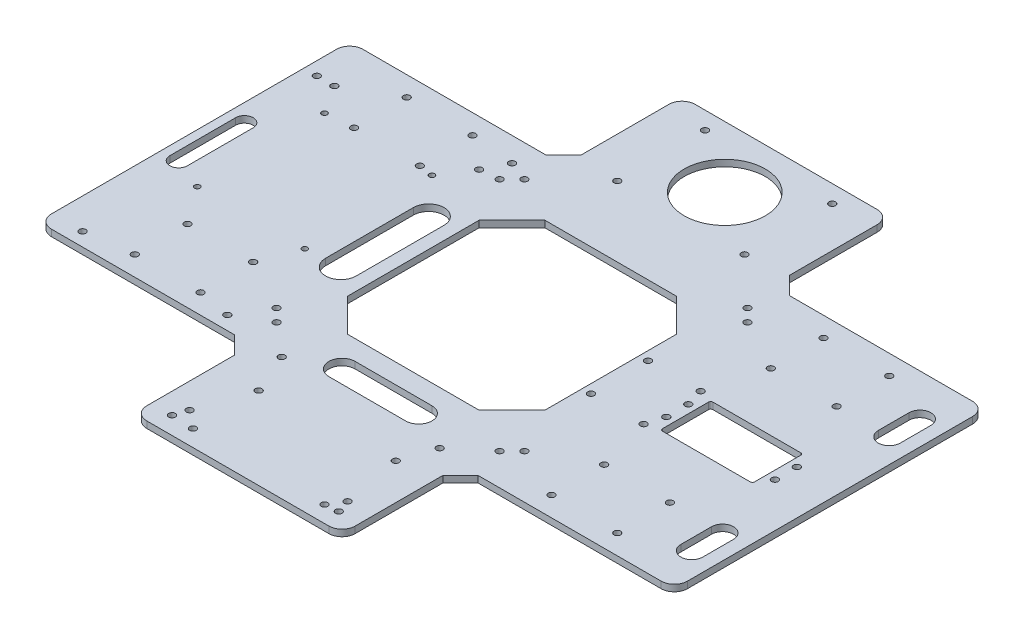
from build123d import *

# Parameters (mm, degrees)
EXTRUDE_1_DEPTH      = 3
SKETCH_2_R           = 1.5
CUT_EXTRUDE_1_DEPTH  = 3
SKETCH_3_R           = 18.5
SKETCH_3_R_2         = 1.5
CUT_EXTRUDE_2_DEPTH  = 10
SKETCH_4_W           = 90
SKETCH_4_H           = 90
CUT_EXTRUDE_3_DEPTH  = 3
FILLET_3_R           = 6
CHAMFER_1_SIZE       = 8
CUT_EXTRUDE_6_DEPTH  = 10
CHAMFER_2_SIZE       = 15
SKETCH_8_R           = 1.5
CUT_EXTRUDE_7_DEPTH  = 10
SKETCH_9_R           = 1.5
CUT_EXTRUDE_8_DEPTH  = 10
CUT_EXTRUDE_9_DEPTH  = 10
SKETCH_14_R          = 1.5
CUT_EXTRUDE_10_DEPTH = 10
SKETCH_15_R          = 1.5
SKETCH_15_W          = 42
SKETCH_15_H          = 23
CUT_EXTRUDE_11_DEPTH = 10
FILLET_4_R           = 1
SKETCH_16_R          = 1.25
CUT_EXTRUDE_12_DEPTH = 10
SKETCH_19_R          = 1.5
CUT_EXTRUDE_13_DEPTH = 10
SKETCH_20_R          = 1.5
CUT_EXTRUDE_14_DEPTH = 10
SKETCH_21_R          = 1.5
CUT_EXTRUDE_15_DEPTH = 10
SKETCH_22_R          = 1.5
CUT_EXTRUDE_16_DEPTH = 10


with BuildPart() as part:
    # 草图1 → 凸台-拉伸1 (new body)
    with BuildSketch(Plane(origin=(0, 0, 0), x_dir=(1, 0, 0), z_dir=(0, 1, 0))):
        Polygon((-47.5, -71), (-47.5, -125), (47.5, -125), (47.5, -71), (145, -71), (145, 71), (47.5, 71), (47.5, 125), (-47.5, 125), (-47.5, 71), (-145, 71), (-145, -71), align=None)
    extrude(amount=EXTRUDE_1_DEPTH)

    # 草图2 → 切除-拉伸1 (cut)
    with BuildSketch(Plane(origin=(0, 3, 0), x_dir=(1, 0, 0), z_dir=(0, 1, 0))):
        with Locations(Location((110, 62, 0), (0, 0, 270))):
            Circle(SKETCH_2_R)
        with Locations(Location((80, 62, 0), (0, 0, 270))):
            Circle(SKETCH_2_R)
        with Locations(Location((80, 38, 0), (0, 0, 270))):
            Circle(SKETCH_2_R)
        with Locations(Location((110, 38, 0), (0, 0, 270))):
            Circle(SKETCH_2_R)
        with Locations(Location((110, -38, 0), (0, 0, 90))):
            Circle(SKETCH_2_R)
        with Locations(Location((110, -62, 0), (0, 0, 90))):
            Circle(SKETCH_2_R)
        with Locations(Location((80, -38, 0), (0, 0, 90))):
            Circle(SKETCH_2_R)
        with Locations(Location((80, -62, 0), (0, 0, 90))):
            Circle(SKETCH_2_R)
        with Locations(Location((-80, -62, 0), (0, 0, 270))):
            Circle(SKETCH_2_R)
        with Locations(Location((-80, -38, 0), (0, 0, 270))):
            Circle(SKETCH_2_R)
        with Locations(Location((-110, -62, 0), (0, 0, 270))):
            Circle(SKETCH_2_R)
        with Locations(Location((-110, -38, 0), (0, 0, 270))):
            Circle(SKETCH_2_R)
        with Locations(Location((-110, 38, 0), (0, 0, 90))):
            Circle(SKETCH_2_R)
        with Locations(Location((-80, 38, 0), (0, 0, 90))):
            Circle(SKETCH_2_R)
        with Locations(Location((-80, 62, 0), (0, 0, 90))):
            Circle(SKETCH_2_R)
        with Locations(Location((-110, 62, 0), (0, 0, 90))):
            Circle(SKETCH_2_R)
    extrude(amount=-CUT_EXTRUDE_1_DEPTH, mode=Mode.SUBTRACT)

    # 草图3 → 切除-拉伸2 (cut)
    with BuildSketch(Plane(origin=(0, 3, 0), x_dir=(1, 0, 0), z_dir=(0, 1, 0))):
        with Locations(Location((0, 97, 0), (0, 0, 270))):
            Circle(SKETCH_3_R)
        with Locations(Location((29, 117, 0), (0, 0, 270))):
            Circle(SKETCH_3_R_2)
        with Locations(Location((29, 77, 0), (0, 0, 270))):
            Circle(SKETCH_3_R_2)
        with Locations(Location((-29, 77, 0), (0, 0, 270))):
            Circle(SKETCH_3_R_2)
        with Locations(Location((-29, 117, 0), (0, 0, 270))):
            Circle(SKETCH_3_R_2)
    extrude(amount=-CUT_EXTRUDE_2_DEPTH, mode=Mode.SUBTRACT)

    # 草图4 → 切除-拉伸3 (cut)
    with BuildSketch(Plane(origin=(0, 3, 0), x_dir=(1, 0, 0), z_dir=(0, 1, 0))):
        Rectangle(SKETCH_4_W, SKETCH_4_H)
    extrude(amount=-CUT_EXTRUDE_3_DEPTH, mode=Mode.SUBTRACT)

    # 圆角3
    fillet_3_edges = [part.edges().sort_by_distance(p)[0] for p in [
        (-145, 1.5, 71),
        (-145, 1.5, -71),
        (-47.5, 1.5, -125),
        (47.5, 1.5, -125),
        (145, 1.5, -71),
        (145, 1.5, 71),
        (47.5, 1.5, 125),
        (-47.5, 1.5, 125),
    ]]
    fillet(fillet_3_edges, radius=FILLET_3_R)

    # 倒角1
    chamfer_1_edges = [part.edges().sort_by_distance(p)[0] for p in [
        (-47.5, 1.5, 71),
        (-47.5, 1.5, -71),
        (47.5, 1.5, -71),
        (47.5, 1.5, 71),
    ]]
    chamfer(chamfer_1_edges, length=CHAMFER_1_SIZE)

    # 草图7 → 切除-拉伸6 (cut)
    with BuildSketch(Plane(origin=(0, 3, 0), x_dir=(1, 0, 0), z_dir=(0, 1, 0))):
        with BuildLine():
            Line((-65, -20), (-65, 20))
            ThreePointArc((-65, 20), (-58, 27), (-51, 20))
            Line((-51, 20), (-51, -20))
            ThreePointArc((-51, -20), (-58, -27), (-65, -20))
        make_face()
        with BuildLine():
            Line((-141, -15), (-141, 15))
            ThreePointArc((-141, 15), (-137, 19), (-133, 15))
            Line((-133, 15), (-133, -15))
            ThreePointArc((-133, -15), (-137, -19), (-141, -15))
        make_face()
        with BuildLine():
            Line((129, 38), (129, 52))
            ThreePointArc((129, 52), (134, 57), (139, 52))
            Line((139, 52), (139, 38))
            ThreePointArc((139, 38), (134, 33), (129, 38))
        make_face()
        with BuildLine():
            Line((129, -38), (129, -52))
            ThreePointArc((129, -52), (134, -57), (139, -52))
            Line((139, -52), (139, -38))
            ThreePointArc((139, -38), (134, -33), (129, -38))
        make_face()
    extrude(amount=-CUT_EXTRUDE_6_DEPTH, mode=Mode.SUBTRACT)

    # 倒角2
    chamfer_2_edges = [part.edges().sort_by_distance(p)[0] for p in [
        (45, 1.5, -45),
        (45, 1.5, 45),
        (-45, 1.5, 45),
        (-45, 1.5, -45),
    ]]
    chamfer(chamfer_2_edges, length=CHAMFER_2_SIZE)

    # 草图8 → 切除-拉伸7 (cut)
    with BuildSketch(Plane(origin=(0, 3, 0), x_dir=(1, 0, 0), z_dir=(0, 1, 0))):
        with Locations(Location((-139, 50, 0), (0, 0, 270))):
            Circle(SKETCH_8_R)
        with Locations(Location((-131, 50, 0), (0, 0, 270))):
            Circle(SKETCH_8_R)
    extrude(amount=-CUT_EXTRUDE_7_DEPTH, mode=Mode.SUBTRACT)

    # 草图9 → 切除-拉伸8 (cut)
    with BuildSketch(Plane(origin=(0, 3, 0), x_dir=(1, 0, 0), z_dir=(0, 1, 0))):
        with Locations(Location((50.843145751, 56.5, 0), (0, 0, 270))):
            Circle(SKETCH_9_R)
        with Locations(Location((56.5, 50.843145751, 0), (0, 0, 270))):
            Circle(SKETCH_9_R)
        with Locations(Location((56.5, -50.843145751, 0), (0, 0, 270))):
            Circle(SKETCH_9_R)
        with Locations(Location((50.843145751, -56.5, 0), (0, 0, 270))):
            Circle(SKETCH_9_R)
        with Locations(Location((-50.843145751, -56.5, 0), (0, 0, 270))):
            Circle(SKETCH_9_R)
        with Locations(Location((-56.5, -50.843145751, 0), (0, 0, 270))):
            Circle(SKETCH_9_R)
        with Locations(Location((-56.5, 50.843145751, 0), (0, 0, 270))):
            Circle(SKETCH_9_R)
        with Locations(Location((-50.843145751, 56.5, 0), (0, 0, 270))):
            Circle(SKETCH_9_R)
        with Locations(Location((-38, -117, 0), (0, 0, 270))):
            Circle(SKETCH_9_R)
        with Locations(Location((38, -117, 0), (0, 0, 270))):
            Circle(SKETCH_9_R)
    extrude(amount=-CUT_EXTRUDE_8_DEPTH, mode=Mode.SUBTRACT)

    # 草图12 → 切除-拉伸9 (cut)
    with BuildSketch(Plane(origin=(0, 3, 0), x_dir=(1, 0, 0), z_dir=(0, 1, 0))):
        with BuildLine():
            Line((-17.5, -54), (17.5, -54))
            ThreePointArc((17.5, -54), (23.5, -60), (17.5, -66))
            Line((17.5, -66), (-17.5, -66))
            ThreePointArc((-17.5, -66), (-23.5, -60), (-17.5, -54))
        make_face()
    extrude(amount=-CUT_EXTRUDE_9_DEPTH, mode=Mode.SUBTRACT)

    # 草图14 → 切除-拉伸10 (cut)
    with BuildSketch(Plane(origin=(0, 3, 0), x_dir=(1, 0, 0), z_dir=(0, 1, 0))):
        with Locations(Location((36, -69, 0), (0, 0, 270))):
            Circle(SKETCH_14_R)
        with Locations(Location((36, -111, 0), (0, 0, 270))):
            Circle(SKETCH_14_R)
        with Locations(Location((-36, -111, 0), (0, 0, 270))):
            Circle(SKETCH_14_R)
        with Locations(Location((-36, -69, 0), (0, 0, 270))):
            Circle(SKETCH_14_R)
    extrude(amount=-CUT_EXTRUDE_10_DEPTH, mode=Mode.SUBTRACT)

    # 草图15 → 切除-拉伸11 (cut)
    with BuildSketch(Plane(origin=(0, 3, 0), x_dir=(1, 0, 0), z_dir=(0, 1, 0))):
        with Locations(Location((75.36, 5, 0), (0, 0, 270))):
            Circle(SKETCH_15_R)
        with Locations(Location((75.36, -5, 0), (0, 0, 270))):
            Circle(SKETCH_15_R)
        with Locations(Location((124.86, -5, 0), (0, 0, 270))):
            Circle(SKETCH_15_R)
        with Locations(Location((124.86, 5, 0), (0, 0, 270))):
            Circle(SKETCH_15_R)
        with Locations((100.11, 0)):
            Rectangle(SKETCH_15_W, SKETCH_15_H)
    extrude(amount=-CUT_EXTRUDE_11_DEPTH, mode=Mode.SUBTRACT)

    # 圆角4
    fillet_4_edges = [part.edges().sort_by_distance(p)[0] for p in [
        (121.11, 1.5, -11.5),
        (121.11, 1.5, 11.5),
        (79.11, 1.5, 11.5),
        (79.11, 1.5, -11.5),
    ]]
    fillet(fillet_4_edges, radius=FILLET_4_R)

    # 草图16 → 切除-拉伸12 (cut)
    with BuildSketch(Plane(origin=(0, 3, 0), x_dir=(1, 0, 0), z_dir=(0, 1, 0))):
        with Locations(Location((-73.5, 37, 0), (0, 0, 270))):
            Circle(SKETCH_16_R)
        with Locations(Location((-122.5, 37, 0), (0, 0, 270))):
            Circle(SKETCH_16_R)
        with Locations(Location((-73.5, -21, 0), (0, 0, 270))):
            Circle(SKETCH_16_R)
        with Locations(Location((-122.5, -21, 0), (0, 0, 270))):
            Circle(SKETCH_16_R)
    extrude(amount=-CUT_EXTRUDE_12_DEPTH, mode=Mode.SUBTRACT)

    # 草图19 → 切除-拉伸13 (cut)
    with BuildSketch(Plane(origin=(0, 3, 0), x_dir=(1, 0, 0), z_dir=(0, 1, 0))):
        with Locations(Location((-65, 50, 0), (0, 0, 270))):
            Circle(SKETCH_19_R)
        with Locations(Location((-131, 50, 0), (0, 0, 270))):
            Circle(SKETCH_19_R)
        with Locations(Location((-65, -64.8, 0), (0, 0, 270))):
            Circle(SKETCH_19_R)
        with Locations(Location((-131, -64.8, 0), (0, 0, 270))):
            Circle(SKETCH_19_R)
    extrude(amount=-CUT_EXTRUDE_13_DEPTH, mode=Mode.SUBTRACT)

    # 草图20 → 切除-拉伸14 (cut)
    with BuildSketch(Plane(origin=(0, 3, 0), x_dir=(1, 0, 0), z_dir=(0, 1, 0))):
        with Locations(Location((-60, 60, 0), (0, 0, 270))):
            Circle(SKETCH_20_R)
    extrude(amount=-CUT_EXTRUDE_14_DEPTH, mode=Mode.SUBTRACT)

    # 草图21 → 切除-拉伸15 (cut)
    with BuildSketch(Plane(origin=(0, 3, 0), x_dir=(1, 0, 0), z_dir=(0, 1, 0))):
        with Locations(Location((31, -84, 0), (0, 0, 270))):
            Circle(SKETCH_21_R)
        with Locations(Location((32, -117.5, 0), (0, 0, 270))):
            Circle(SKETCH_21_R)
        with Locations(Location((-28, -87.5, 0), (0, 0, 270))):
            Circle(SKETCH_21_R)
        with Locations(Location((-28, -117.5, 0), (0, 0, 270))):
            Circle(SKETCH_21_R)
    extrude(amount=-CUT_EXTRUDE_15_DEPTH, mode=Mode.SUBTRACT)

    # 草图22 → 切除-拉伸16 (cut)
    with BuildSketch(Plane(origin=(0, 3, 0), x_dir=(1, 0, 0), z_dir=(0, 1, 0))):
        with Locations(Location((73, 13, 0), (0, 0, 270))):
            Circle(SKETCH_22_R)
        with Locations(Location((49, 13, 0), (0, 0, 270))):
            Circle(SKETCH_22_R)
        with Locations(Location((73, -13, 0), (0, 0, 270))):
            Circle(SKETCH_22_R)
        with Locations(Location((49, -13, 0), (0, 0, 270))):
            Circle(SKETCH_22_R)
    extrude(amount=-CUT_EXTRUDE_16_DEPTH, mode=Mode.SUBTRACT)


solid = part.part
